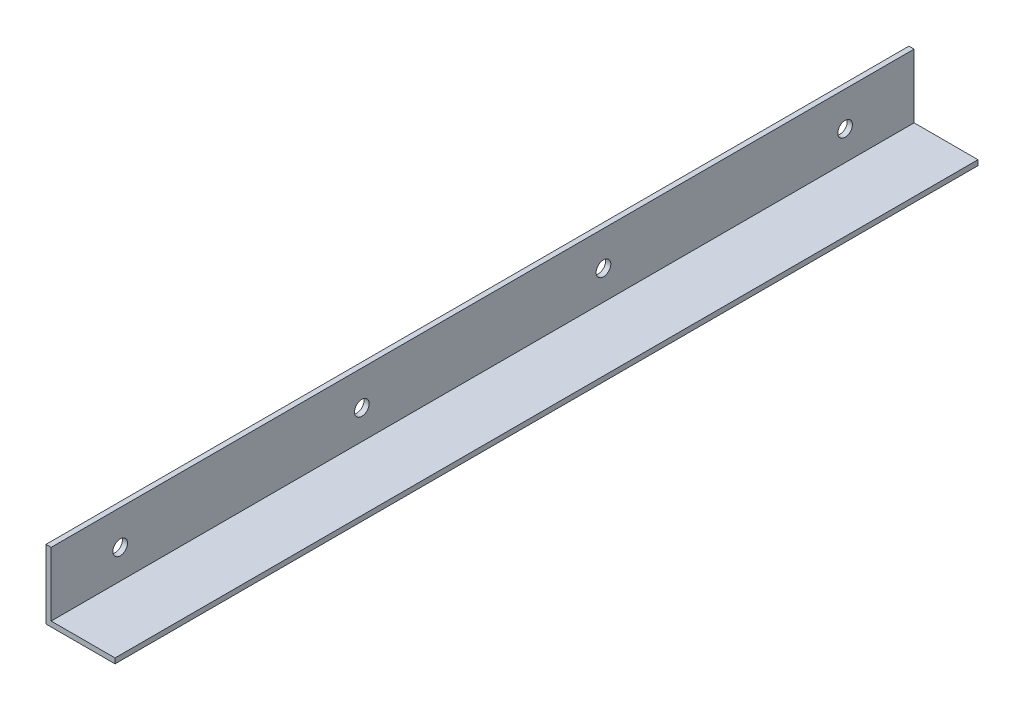
from build123d import *

# Parameters (mm, degrees)
Y_KSEKLIK_EKSTR_ZYON1_DEPTH = 500
IZIM2_R                     = 4.25
KES_EKSTR_ZYON1_DEPTH       = 10


with BuildPart() as part:
    # Çizim1 → Yükseklik-Ekstrüzyon1 (new body)
    with BuildSketch(Plane.XY):
        Polygon((0, 0), (0, 40), (3, 40), (3, 3), (40, 3), (40, 0), align=None)
    extrude(amount=Y_KSEKLIK_EKSTR_ZYON1_DEPTH)

    # Çizim2 → Kes-Ekstrüzyon1 (cut)
    with BuildSketch(Plane.ZY):
        with Locations((40, 20)):
            Circle(IZIM2_R)
        with Locations((180, 20)):
            Circle(IZIM2_R)
        with Locations((320, 20)):
            Circle(IZIM2_R)
        with Locations((460, 20)):
            Circle(IZIM2_R)
    extrude(amount=-KES_EKSTR_ZYON1_DEPTH, mode=Mode.SUBTRACT)


solid = part.part
